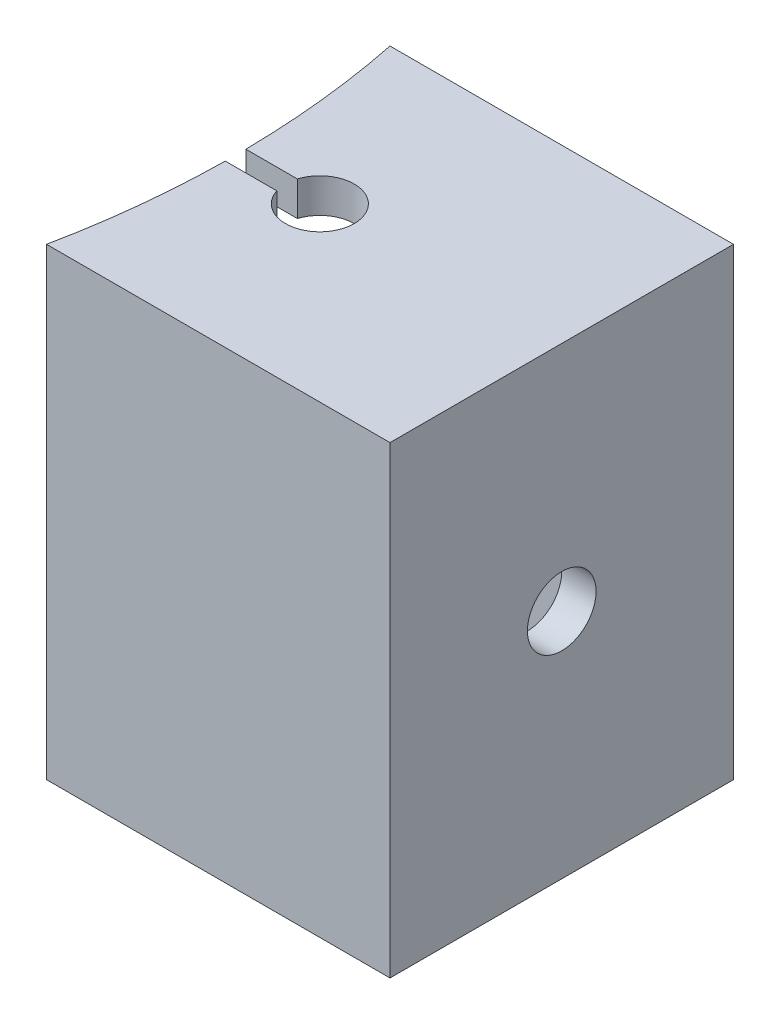
from build123d import *

# Parameters (mm, degrees)
BOSS_EXTRUDE1_DEPTH = 27
SHELL3_T            = -2
CUT_EXTRUDE1_DEPTH  = 2


with BuildPart() as part:
    # Sketch2 → Boss-Extrude1 (new body)
    with BuildSketch(Plane(origin=(0, 0, 0), x_dir=(1, 0, 0), z_dir=(0, 1, 0))):
        with BuildLine():
            Line((-18.993396104, 10.600093214), (-15.993396104, 10.600093214))
            ThreePointArc((-15.993396104, 10.600093214), (-12.085516583, 10.0001005), (-15.993393867, 9.400093214))
            Line((-15.993393867, 9.400093214), (-18.993393867, 9.400093214))
            ThreePointArc((-18.993393867, 9.400093214), (-19.274030957, 4.676202489), (-20, 0))
            Line((-20, 0), (0, 0))
            Line((0, 0), (0, 20))
            Line((0, 20), (-20, 20))
            ThreePointArc((-20, 20), (-19.274040883, 15.323890203), (-18.993396104, 10.600093214))
        make_face()
    extrude(amount=BOSS_EXTRUDE1_DEPTH)

    # Shell3
    shell3_openings = [part.faces().sort_by_distance(p)[0] for p in [
        (-19.274030957, 13.5, -4.676202489),
        (-17.493393867, 13.5, -9.400093214),
        (-12.085516583, 13.5, -10.0001005),
        (-17.493396104, 13.5, -10.600093214),
        (-19.274040883, 13.5, -15.323890203),
    ]]
    offset(amount=SHELL3_T, openings=shell3_openings, kind=Kind.INTERSECTION)

    # Sketch3 → Cut-Extrude1 (cut)
    with BuildSketch(Plane(origin=(0, 0, 0), x_dir=(0, 0, -1), z_dir=(1, 0, 0))):
        with BuildLine():
            ThreePointArc((12, 13.5), (10.89974713, 15.286184509), (8.809544899, 15.107114387))
            Line((8.809544899, 15.107114387), (11.190455101, 11.892885613))
            ThreePointArc((11.190455101, 11.892885613), (11.786184509, 12.60025287), (12, 13.5))
        make_face()
        with BuildLine():
            Line((11.190455101, 11.892885613), (8.809544899, 15.107114387))
            ThreePointArc((8.809544899, 15.107114387), (8.392885613, 12.309544899), (11.190455101, 11.892885613))
        make_face()
    extrude(amount=-CUT_EXTRUDE1_DEPTH, mode=Mode.SUBTRACT)


solid = part.part
